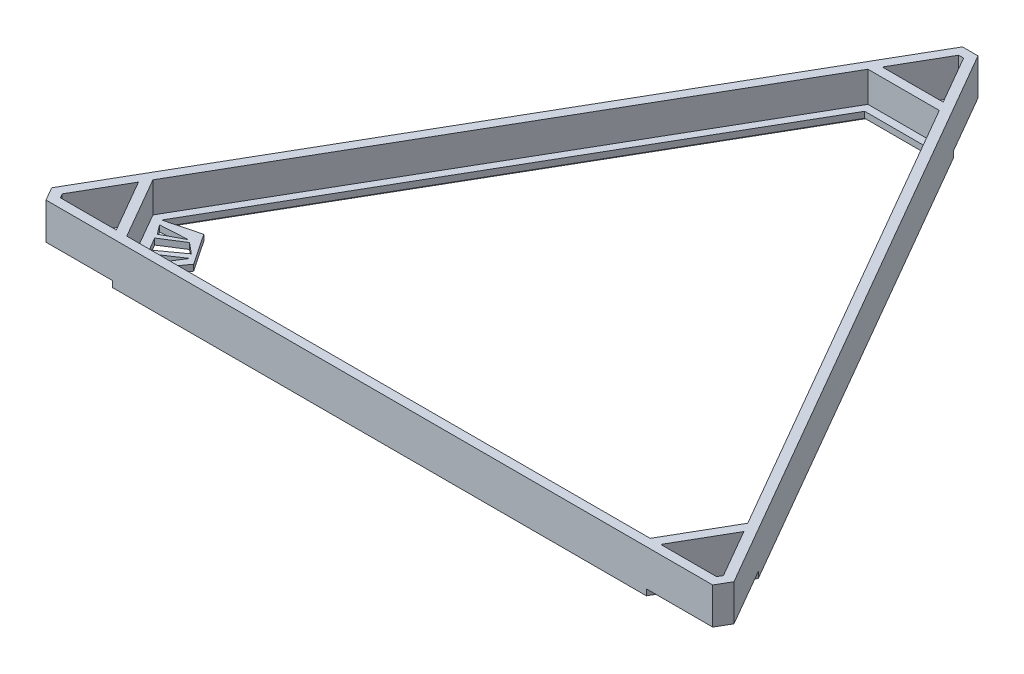
from build123d import *

# Parameters (mm, degrees)
BOSS_EXTRUDE1_DEPTH = 12
BOSS_EXTRUDE2_DEPTH = 2
BOSS_EXTRUDE3_DEPTH = 2


with BuildPart() as part:
    # Sketch1 → Boss-Extrude1 (new body)
    with BuildSketch(Plane(origin=(0, 0, 0), x_dir=(1, 0, 0), z_dir=(0, 1, 0))):
        Polygon((109.556624327, -4.42820323), (-109.556624327, -4.42820323), (-112.113248654, 0), (-2.556624327, 189.75763964), (2.556624327, 189.75763964), (112.113248654, 0), align=None)
        Polygon((-107.824573519, -1.42820323), (-108.649147039, 0), (-99.473720558, 15.892304845), (-89.473720558, -1.42820323), align=None, mode=Mode.SUBTRACT)
        Polygon((-0.824573519, 186.75763964), (0.824573519, 186.75763964), (10, 170.865334795), (-10, 170.865334795), align=None, mode=Mode.SUBTRACT)
        Polygon((108.649147039, 0), (107.824573519, -1.42820323), (89.473720558, -1.42820323), (99.473720558, 15.892304845), align=None, mode=Mode.SUBTRACT)
        Polygon((-11.732050808, 167.865334795), (11.732050808, 167.865334795), (97.741669751, 18.892304845), (86.009618943, -1.42820323), (-86.009618943, -1.42820323), (-97.741669751, 18.892304845), align=None, mode=Mode.SUBTRACT)
    extrude(amount=BOSS_EXTRUDE1_DEPTH)

    # Sketch1<4> → Boss-Extrude2 (add)
    with BuildSketch(Plane(origin=(0, 0, 0), x_dir=(1, 0, 0), z_dir=(0, 1, 0))):
        Polygon((11.732050808, 167.865334795), (-11.732050808, 167.865334795), (-97.741669751, 18.892304845), (-86.009618943, -1.42820323), (86.009618943, -1.42820323), (97.741669751, 18.892304845), align=None)
        Polygon((-88.382267396, 8.337401941), (-90.881111336, 12.619059055), (-83.883666799, 17.070781447), (-80.350783684, 14.134361385), align=None, mode=Mode.SUBTRACT)
        Polygon((-84.88364511, 17.690172506), (-91.540804962, 14.134361385), (-93.854918405, 17.160254038), align=None, mode=Mode.SUBTRACT)
        Polygon((-87.382389068, 7.232050808), (-79.257069687, 12.619059055), (-85.56624327, 2.803847577), align=None, mode=Mode.SUBTRACT)
        Polygon((84.56624327, 1.07179677), (-84.56624327, 1.07179677), (-77.039200778, 11.574081455), (-83.883666799, 21.745187386), (-94.854918405, 18.892304845), (-10.288675135, 165.365334795), (10.288675135, 165.365334795), (94.854918405, 18.892304845), align=None, mode=Mode.SUBTRACT)
    extrude(amount=BOSS_EXTRUDE2_DEPTH)

    # Sketch2 → Boss-Extrude3 (add)
    with BuildSketch(Plane.XZ):
        Polygon((101.205771366, -18.892304845), (87.741669751, 4.42820323), (-87.741669751, 4.42820323), (-101.205771366, -18.892304845), (-13.464101615, -170.865334795), (13.464101615, -170.865334795), align=None)
        Polygon((-11.732050807, -167.865334795), (11.732050807, -167.865334795), (97.741669751, -18.892304845), (86.009618943, 1.42820323), (-86.009618943, 1.42820323), (-97.741669751, -18.892304845), align=None, mode=Mode.SUBTRACT)
    extrude(amount=BOSS_EXTRUDE3_DEPTH)


solid = part.part
